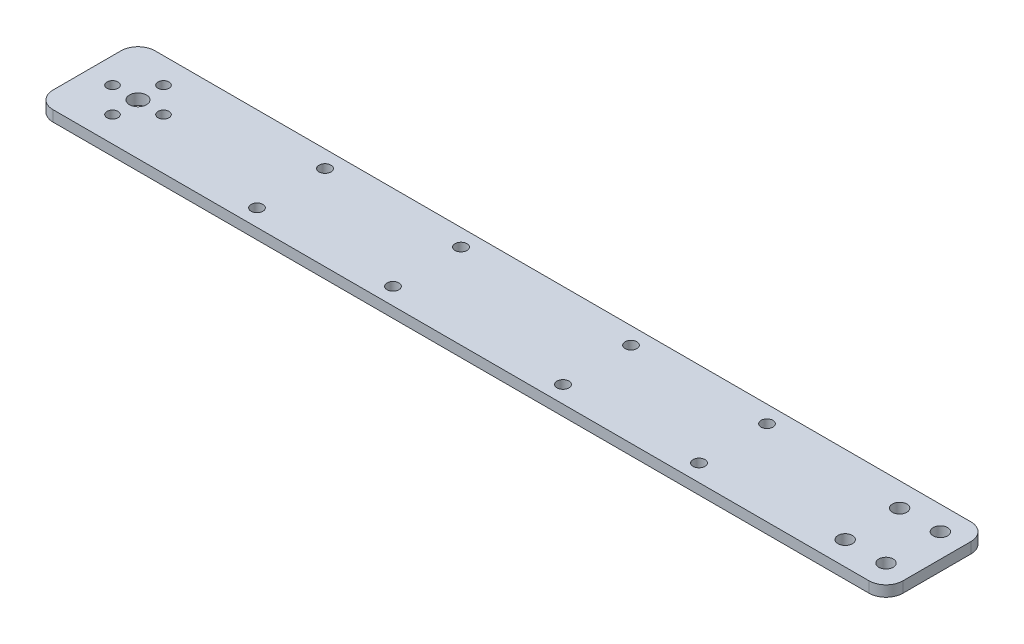
from build123d import *

# Parameters (mm, degrees)
SKETCH1_W           = 250
SKETCH1_H           = 30
BOSS_EXTRUDE1_DEPTH = 3.175
FILLET1_R           = 5
SKETCH2_R           = 2.5
CUT_EXTRUDE1_DEPTH  = 236.499640393
SKETCH3_R           = 1.625
CUT_EXTRUDE3_DEPTH  = 236.499640393
SKETCH4_R           = 1.75
CUT_EXTRUDE4_DEPTH  = 10
SKETCH5_R           = 2.125
CUT_EXTRUDE5_DEPTH  = 236.499640393


with BuildPart() as part:
    # Sketch1 → Boss-Extrude1 (new body)
    with BuildSketch(Plane(origin=(0, 0, 0), x_dir=(1, 0, 0), z_dir=(0, 1, 0))):
        with Locations((110, 0)):
            Rectangle(SKETCH1_W, SKETCH1_H)
    extrude(amount=BOSS_EXTRUDE1_DEPTH)

    # Fillet1
    fillet1_edges = [part.edges().sort_by_distance(p)[0] for p in [
        (-15, 1.5875, -15),
        (235, 1.5875, -15),
        (235, 1.5875, 15),
        (-15, 1.5875, 15),
    ]]
    fillet(fillet1_edges, radius=FILLET1_R)

    # Sketch2 → Cut-Extrude1 (cut, through all)
    with BuildSketch(Plane(origin=(0, 3.175, 0), x_dir=(1, 0, 0), z_dir=(0, 1, 0))):
        with Locations(Location((0, 0, 0), (0, 0, 270))):
            Circle(SKETCH2_R)
    extrude(amount=-CUT_EXTRUDE1_DEPTH, mode=Mode.SUBTRACT)

    # Sketch3 → Cut-Extrude3 (cut, through all)
    with BuildSketch(Plane(origin=(0, 3.175, 0), x_dir=(1, 0, 0), z_dir=(0, 1, 0))):
        with Locations(Location((7.5, 0, 0), (0, 0, 270))):
            Circle(SKETCH3_R)
        with Locations(Location((0, -7.5, 0), (0, 0, 270))):
            Circle(SKETCH3_R)
        with Locations(Location((-7.5, 0, 0), (0, 0, 270))):
            Circle(SKETCH3_R)
        with Locations(Location((0, 7.5, 0), (0, 0, 270))):
            Circle(SKETCH3_R)
    extrude(amount=-CUT_EXTRUDE3_DEPTH, mode=Mode.SUBTRACT)

    # Sketch4 → Cut-Extrude4 (cut)
    with BuildSketch(Plane(origin=(0, 3.175, 0), x_dir=(1, 0, 0), z_dir=(0, 1, 0))):
        with Locations(Location((85, -10, 0), (0, 0, 270))):
            Circle(SKETCH4_R)
        with Locations(Location((135, -10, 0), (0, 0, 270))):
            Circle(SKETCH4_R)
        with Locations(Location((135, 10, 0), (0, 0, 270))):
            Circle(SKETCH4_R)
        with Locations(Location((85, 10, 0), (0, 0, 270))):
            Circle(SKETCH4_R)
        with Locations(Location((175, -10, 0), (0, 0, 270))):
            Circle(SKETCH4_R)
        with Locations(Location((175, 10, 0), (0, 0, 270))):
            Circle(SKETCH4_R)
        with Locations(Location((45, -10, 0), (0, 0, 270))):
            Circle(SKETCH4_R)
        with Locations(Location((45, 10, 0), (0, 0, 270))):
            Circle(SKETCH4_R)
    extrude(amount=-CUT_EXTRUDE4_DEPTH, mode=Mode.SUBTRACT)

    # Sketch5 → Cut-Extrude5 (cut, through all)
    with BuildSketch(Plane(origin=(0, 3.175, 0), x_dir=(1, 0, 0), z_dir=(0, 1, 0))):
        with Locations(Location((216, 8, 0), (0, 0, 270))):
            Circle(SKETCH5_R)
        with Locations(Location((228, 8, 0), (0, 0, 90))):
            Circle(SKETCH5_R)
        with Locations(Location((228, -8, 0), (0, 0, 270))):
            Circle(SKETCH5_R)
        with Locations(Location((216, -8, 0), (0, 0, 90))):
            Circle(SKETCH5_R)
    extrude(amount=-CUT_EXTRUDE5_DEPTH, mode=Mode.SUBTRACT)


solid = part.part
